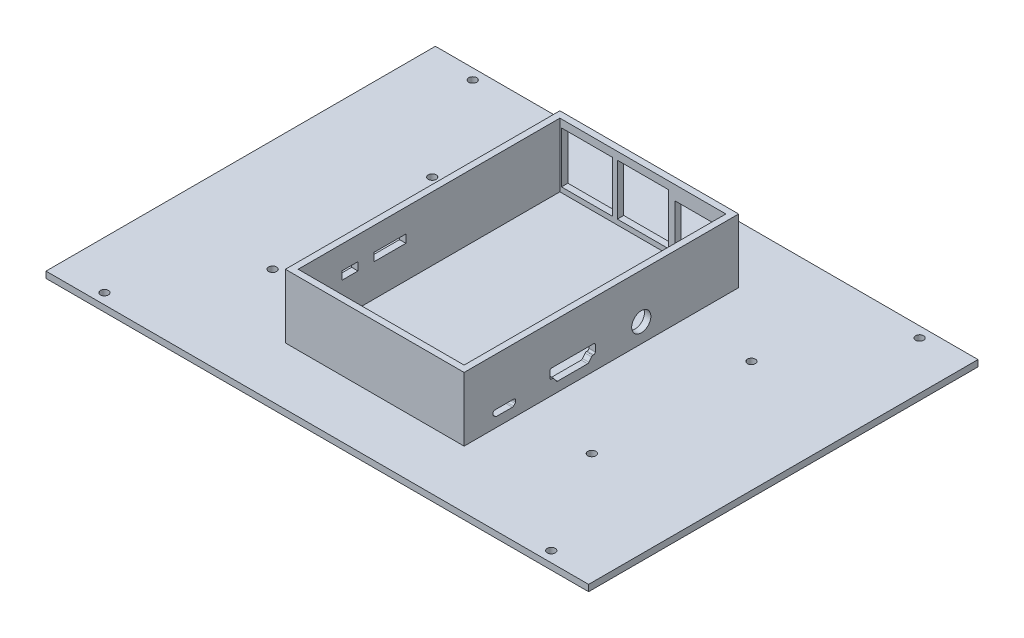
from build123d import *

# Parameters (mm, degrees)
ESQUISSE1_W                               = 170
ESQUISSE1_H                               = 122
BOSS_EXTRU_1_DEPTH                        = 2
TROU_POUR_TARAUDAGE_POUR_TROU_TARAUD_M3_D = 2.5
ESQUISSE4_W                               = 56
ESQUISSE4_H                               = 86
BOSS_EXTRU_2_DEPTH                        = 20
COQUE1_T                                  = -2
ENL_V_MAT_EXTRU_1_REACH                   = 132.284
ESQUISSE5_R                               = 3
ENL_V_MAT_EXTRU_2_REACH                   = 138.107
ESQUISSE6_W                               = 16
ESQUISSE6_H                               = 16
ESQUISSE6_H_2                             = 14
ENL_V_MAT_EXTRU_3_REACH                   = 132.284
ESQUISSE7_W                               = 10
ESQUISSE7_H                               = 2.54
ESQUISSE7_W_2                             = 5


with BuildPart() as part:
    # Esquisse1 → Boss.-Extru.1 (new body)
    with BuildSketch(Plane(origin=(0, 0, 0), x_dir=(1, 0, 0), z_dir=(0, 1, 0))):
        Rectangle(ESQUISSE1_W, ESQUISSE1_H)
    extrude(amount=BOSS_EXTRU_1_DEPTH)

    # Trou pour taraudage pour trou taraudé M3x0.51 (through all)
    with Locations(Plane(origin=(0, 2, 0), x_dir=(1, 0, 0), z_dir=(0, 1, 0))):
        with Locations((-50, 25), (50, 25), (50, -25), (-50, -25), (70, 57.7), (-70, -57.7), (-70, 57.7), (70, -57.7)):
            Hole(TROU_POUR_TARAUDAGE_POUR_TROU_TARAUD_M3_D / 2)

    # Esquisse4 → Boss.-Extru.2 (add)
    with BuildSketch(Plane.XZ.offset(-2)):
        Rectangle(ESQUISSE4_W, ESQUISSE4_H)
    extrude(amount=-BOSS_EXTRU_2_DEPTH)

    # Coque1
    coque1_openings = [part.faces().sort_by_distance(p)[0] for p in [
        (0, 22, 0),
    ]]
    offset(amount=COQUE1_T, openings=coque1_openings, kind=Kind.INTERSECTION)

    # Esquisse5 → Enlèv. mat.-Extru.1 (cut, up to next)
    with BuildSketch(Plane(origin=(28, 0, 0), x_dir=(0, 0, -1), z_dir=(1, 0, 0)), mode=Mode.PRIVATE) as enl_v_mat_extru_1_sk1:
        with Locations((12.5, 8)):
            Circle(ESQUISSE5_R)
    enl_v_mat_extru_1_tool1 = extrude(enl_v_mat_extru_1_sk1.sketch, amount=-ENL_V_MAT_EXTRU_1_REACH, mode=Mode.PRIVATE) & part.part
    # Esquisse5 → Enlèv. mat.-Extru.1 (cut, up to next)
    with BuildSketch(Plane(origin=(28, 0, 0), x_dir=(0, 0, -1), z_dir=(1, 0, 0)), mode=Mode.PRIVATE) as enl_v_mat_extru_1_sk2:
        with BuildLine():
            Line((-33.4, 7), (-27.4, 7))
            ThreePointArc((-27.4, 7), (-27.046446609, 6.853553391), (-26.9, 6.5))
            Line((-26.9, 6.5), (-26.9, 5.957106781))
            ThreePointArc((-26.9, 5.957106781), (-26.938060234, 5.765765065), (-27.046446609, 5.603553391))
            Line((-27.046446609, 5.603553391), (-27.503553391, 5.146446609))
            ThreePointArc((-27.503553391, 5.146446609), (-27.665765065, 5.038060234), (-27.857106781, 5))
            Line((-27.857106781, 5), (-32.942893219, 5))
            ThreePointArc((-32.942893219, 5), (-33.134234935, 5.038060234), (-33.296446609, 5.146446609))
            Line((-33.296446609, 5.146446609), (-33.753553391, 5.603553391))
            ThreePointArc((-33.753553391, 5.603553391), (-33.861939766, 5.765765065), (-33.9, 5.957106781))
            Line((-33.9, 5.957106781), (-33.9, 6.5))
            ThreePointArc((-33.9, 6.5), (-33.753553391, 6.853553391), (-33.4, 7))
        make_face()
    enl_v_mat_extru_1_tool2 = extrude(enl_v_mat_extru_1_sk2.sketch, amount=-ENL_V_MAT_EXTRU_1_REACH, mode=Mode.PRIVATE) & part.part
    # Esquisse5 → Enlèv. mat.-Extru.1 (cut, up to next)
    with BuildSketch(Plane(origin=(28, 0, 0), x_dir=(0, 0, -1), z_dir=(1, 0, 0)), mode=Mode.PRIVATE) as enl_v_mat_extru_1_sk3:
        with BuildLine():
            Line((-15.6, 9.5), (-2.4, 9.5))
            ThreePointArc((-2.4, 9.5), (-2.046446609, 9.353553391), (-1.9, 9))
            Line((-1.9, 9), (-1.9, 7))
            ThreePointArc((-1.9, 7), (-2.046446609, 6.646446609), (-2.4, 6.5))
            Line((-2.4, 6.5), (-2.696630825, 6.5))
            ThreePointArc((-2.696630825, 6.5), (-2.922638662, 6.446004998), (-3.099833323, 6.295681832))
            Line((-3.099833323, 6.295681832), (-3.900166677, 5.204318168))
            ThreePointArc((-3.900166677, 5.204318168), (-4.077361338, 5.053995002), (-4.303369175, 5))
            Line((-4.303369175, 5), (-13.696630825, 5))
            ThreePointArc((-13.696630825, 5), (-13.922638662, 5.053995002), (-14.099833323, 5.204318168))
            Line((-14.099833323, 5.204318168), (-14.900166677, 6.295681832))
            ThreePointArc((-14.900166677, 6.295681832), (-15.077361338, 6.446004998), (-15.303369175, 6.5))
            Line((-15.303369175, 6.5), (-15.6, 6.5))
            ThreePointArc((-15.6, 6.5), (-15.953553391, 6.646446609), (-16.1, 7))
            Line((-16.1, 7), (-16.1, 9))
            ThreePointArc((-16.1, 9), (-15.953553391, 9.353553391), (-15.6, 9.5))
        make_face()
    enl_v_mat_extru_1_tool3 = extrude(enl_v_mat_extru_1_sk3.sketch, amount=-ENL_V_MAT_EXTRU_1_REACH, mode=Mode.PRIVATE) & part.part
    add(enl_v_mat_extru_1_tool1.solids().sort_by_distance((28, 8, -12.5))[0], mode=Mode.SUBTRACT)
    add(enl_v_mat_extru_1_tool2.solids().sort_by_distance((28, 6.025513, 30.4))[0], mode=Mode.SUBTRACT)
    add(enl_v_mat_extru_1_tool3.solids().sort_by_distance((28, 7.376996, 9))[0], mode=Mode.SUBTRACT)

    # Esquisse6 → Enlèv. mat.-Extru.2 (cut, up to next)
    with BuildSketch(Plane(origin=(0, 0, -43), x_dir=(-1, 0, 0), z_dir=(0, 0, -1)), mode=Mode.PRIVATE) as enl_v_mat_extru_2_sk1:
        with Locations((17.5, 11.6)):
            Rectangle(ESQUISSE6_W, ESQUISSE6_H)
    enl_v_mat_extru_2_tool1 = extrude(enl_v_mat_extru_2_sk1.sketch, amount=-ENL_V_MAT_EXTRU_2_REACH, mode=Mode.PRIVATE) & part.part
    # Esquisse6 → Enlèv. mat.-Extru.2 (cut, up to next)
    with BuildSketch(Plane(origin=(0, 0, -43), x_dir=(-1, 0, 0), z_dir=(0, 0, -1)), mode=Mode.PRIVATE) as enl_v_mat_extru_2_sk2:
        with Locations((0, 11.6)):
            Rectangle(ESQUISSE6_W, ESQUISSE6_H)
    enl_v_mat_extru_2_tool2 = extrude(enl_v_mat_extru_2_sk2.sketch, amount=-ENL_V_MAT_EXTRU_2_REACH, mode=Mode.PRIVATE) & part.part
    # Esquisse6 → Enlèv. mat.-Extru.2 (cut, up to next)
    with BuildSketch(Plane(origin=(0, 0, -43), x_dir=(-1, 0, 0), z_dir=(0, 0, -1)), mode=Mode.PRIVATE) as enl_v_mat_extru_2_sk3:
        with Locations((-18, 10.6)):
            Rectangle(ESQUISSE6_W, ESQUISSE6_H_2)
    enl_v_mat_extru_2_tool3 = extrude(enl_v_mat_extru_2_sk3.sketch, amount=-ENL_V_MAT_EXTRU_2_REACH, mode=Mode.PRIVATE) & part.part
    add(enl_v_mat_extru_2_tool1.solids().sort_by_distance((-17.5, 11.6, -43))[0], mode=Mode.SUBTRACT)
    add(enl_v_mat_extru_2_tool2.solids().sort_by_distance((0, 11.6, -43))[0], mode=Mode.SUBTRACT)
    add(enl_v_mat_extru_2_tool3.solids().sort_by_distance((18, 10.6, -43))[0], mode=Mode.SUBTRACT)

    # Esquisse7 → Enlèv. mat.-Extru.3 (cut, up to next)
    with BuildSketch(Plane.ZY.offset(28), mode=Mode.PRIVATE) as enl_v_mat_extru_3_sk1:
        with Locations((12.251607125, 13.425584158)):
            Rectangle(ESQUISSE7_W, ESQUISSE7_H)
    enl_v_mat_extru_3_tool1 = extrude(enl_v_mat_extru_3_sk1.sketch, amount=-ENL_V_MAT_EXTRU_3_REACH, mode=Mode.PRIVATE) & part.part
    # Esquisse7 → Enlèv. mat.-Extru.3 (cut, up to next)
    with BuildSketch(Plane.ZY.offset(28), mode=Mode.PRIVATE) as enl_v_mat_extru_3_sk2:
        with Locations((24.751607125, 13.425584158)):
            Rectangle(ESQUISSE7_W_2, ESQUISSE7_H)
    enl_v_mat_extru_3_tool2 = extrude(enl_v_mat_extru_3_sk2.sketch, amount=-ENL_V_MAT_EXTRU_3_REACH, mode=Mode.PRIVATE) & part.part
    add(enl_v_mat_extru_3_tool1.solids().sort_by_distance((-28, 13.425584, 12.251607))[0], mode=Mode.SUBTRACT)
    add(enl_v_mat_extru_3_tool2.solids().sort_by_distance((-28, 13.425584, 24.751607))[0], mode=Mode.SUBTRACT)


solid = part.part
